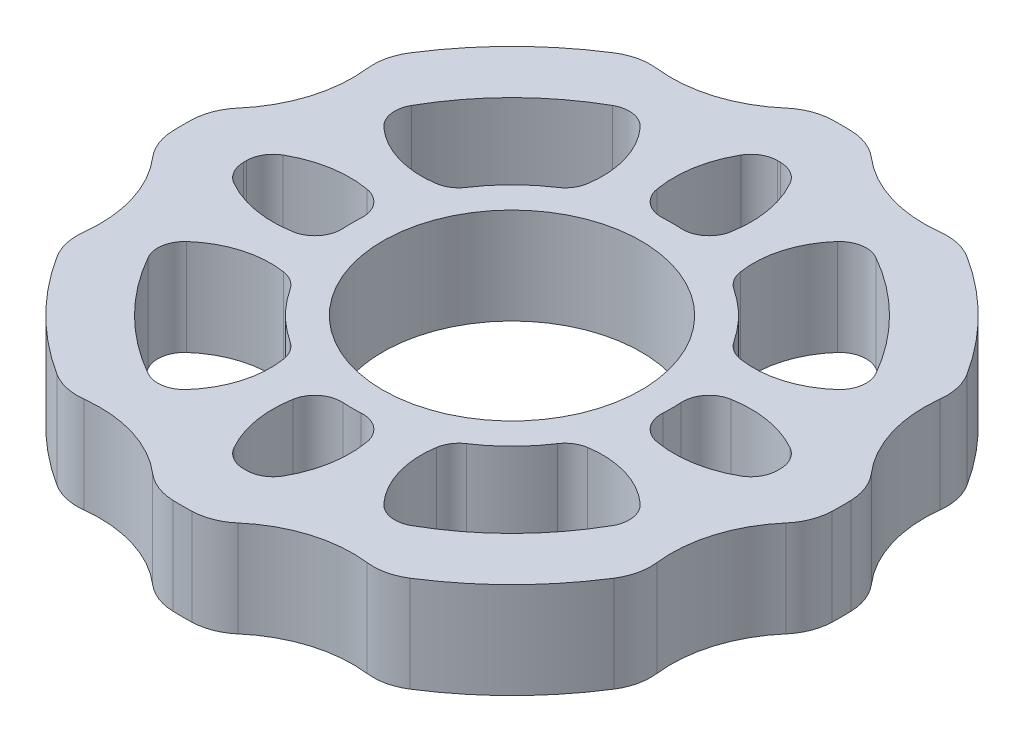
from build123d import *

# Parameters (mm, degrees)
SKIZZE1_R                       = 61.75
AUFSATZ_LINEAR_AUSTRAGEN1_DEPTH = 18
SKIZZE2_R                       = 24
SCHNITT_LINEAR_AUSTRAGEN1_DEPTH = 90.163473463
VERRUNDUNG1_R                   = 10
SCHNITT_LINEAR_AUSTRAGEN3_DEPTH = 90.163473622
SKIZZE6_R                       = 24.2
SCHNITT_LINEAR_AUSTRAGEN4_DEPTH = 90.163473622
KREISMUSTER1_COUNT              = 4
VERRUNDUNG1_OF_KREISMUSTER1_R   = 10
SCHNITT_LINEAR_AUSTRAGEN5_DEPTH = 90.163473622
VERRUNDUNG2_R                   = 5
KREISMUSTER2_COUNT              = 4
VERRUNDUNG2_OF_KREISMUSTER2_R   = 5
SKALIEREN1_SCALE                = 0.13


with BuildPart() as part:
    # Skizze1 → Aufsatz-Linear austragen1 (new body)
    with BuildSketch(Plane(origin=(0, 0, 0), x_dir=(1, 0, 0), z_dir=(0, 1, 0))):
        with Locations(Location((0, 0, 0), (0, 0, 270))):
            Circle(SKIZZE1_R)
    extrude(amount=AUFSATZ_LINEAR_AUSTRAGEN1_DEPTH)

    # Skizze2 → Schnitt-Linear austragen1 (cut, through all)
    with BuildSketch(Plane(origin=(0, 18, 0), x_dir=(1, 0, 0), z_dir=(0, 1, 0))):
        with Locations((23.68, 77.47)):
            Circle(SKIZZE2_R)
        with Locations((-23.68, 77.47)):
            Circle(SKIZZE2_R)
    schnitt_linear_austragen1 = extrude(amount=-SCHNITT_LINEAR_AUSTRAGEN1_DEPTH, mode=Mode.SUBTRACT)

    # Verrundung1
    verrundung1_edges = [part.edges().sort_by_distance(p)[0] for p in [
        (-29.577004439, 9, -54.205749773),
        (-5.783829144, 9, -61.478531378),
        (5.783829144, 9, -61.478531378),
        (29.577004439, 9, -54.205749773),
    ]]
    fillet(verrundung1_edges, radius=VERRUNDUNG1_R)

    # Skizze5 → Schnitt-Linear austragen3 (cut, through all)
    with BuildSketch(Plane(origin=(0, 18, 0), x_dir=(1, 0, 0), z_dir=(0, 1, 0))):
        with BuildLine():
            ThreePointArc((2.959586903, 49.912331596), (0, 50), (-2.959586903, 49.912331596))
            ThreePointArc((-2.959586903, 49.912331596), (-7.073744655, 40.055154921), (-5.527959125, 29.486296273))
            ThreePointArc((-5.527959125, 29.486296273), (0, 30), (5.527959125, 29.486296273))
            ThreePointArc((5.527959125, 29.486296273), (7.073744655, 40.055154921), (2.959586903, 49.912331596))
        make_face()
    schnitt_linear_austragen3 = extrude(amount=-SCHNITT_LINEAR_AUSTRAGEN3_DEPTH, mode=Mode.SUBTRACT)

    # Skizze6 → Schnitt-Linear austragen4 (cut, through all)
    with BuildSketch(Plane(origin=(0, 18, 0), x_dir=(1, 0, 0), z_dir=(0, 1, 0))):
        with Locations(Location((0, 0, 0), (0, 0, 270))):
            Circle(SKIZZE6_R)
    extrude(amount=-SCHNITT_LINEAR_AUSTRAGEN4_DEPTH, mode=Mode.SUBTRACT)

    # Kreismuster1: Schnitt-Linear austragen1, Schnitt-Linear austragen3 ×4 about axis
    kreismuster1_axis = Axis((0, 0, 0), (0, 1, 0))
    add([schnitt_linear_austragen1.rotate(kreismuster1_axis, i * 360 / KREISMUSTER1_COUNT) for i in range(1, KREISMUSTER1_COUNT)], mode=Mode.SUBTRACT)
    add([schnitt_linear_austragen3.rotate(kreismuster1_axis, i * 360 / KREISMUSTER1_COUNT) for i in range(1, KREISMUSTER1_COUNT)], mode=Mode.SUBTRACT)

    # Verrundung1 of Kreismuster1
    verrundung1_of_kreismuster1_edges = [part.edges().sort_by_distance(p)[0] for p in [
        (-54.205749773, 9, 29.577004439),
        (-61.478531378, 9, 5.783829144),
        (-61.478531378, 9, -5.783829144),
        (-54.205749773, 9, -29.577004439),
        (29.577004439, 9, 54.205749773),
        (5.783829144, 9, 61.478531378),
        (-5.783829144, 9, 61.478531378),
        (-29.577004439, 9, 54.205749773),
        (54.205749773, 9, -29.577004439),
        (61.478531378, 9, -5.783829144),
        (61.478531378, 9, 5.783829144),
        (54.205749773, 9, 29.577004439),
    ]]
    fillet(verrundung1_of_kreismuster1_edges, radius=VERRUNDUNG1_OF_KREISMUSTER1_R)

    # Skizze7 → Schnitt-Linear austragen5 (cut, through all)
    with BuildSketch(Plane(origin=(0, 18, 0), x_dir=(1, 0, 0), z_dir=(0, 1, 0))):
        with BuildLine():
            ThreePointArc((-14.885049849, 26.046790416), (-15.051255942, 36.683162183), (-21.506435351, 45.138378775))
            ThreePointArc((-21.506435351, 45.138378775), (-35.355339059, 35.355339059), (-45.138378775, 21.506435351))
            ThreePointArc((-45.138378775, 21.506435351), (-36.683162183, 15.051255942), (-26.046790416, 14.885049849))
            ThreePointArc((-26.046790416, 14.885049849), (-21.213203436, 21.213203436), (-14.885049849, 26.046790416))
        make_face()
    schnitt_linear_austragen5 = extrude(amount=-SCHNITT_LINEAR_AUSTRAGEN5_DEPTH, mode=Mode.SUBTRACT)

    # Verrundung2
    verrundung2_edges = [part.edges().sort_by_distance(p)[0] for p in [
        (-29.486296273, 9, 5.527959125),
        (-49.912331596, 9, 2.959586903),
        (-49.912331596, 9, -2.959586903),
        (-29.486296273, 9, -5.527959125),
        (5.527959125, 9, 29.486296273),
        (2.959586903, 9, 49.912331596),
        (-2.959586903, 9, 49.912331596),
        (-5.527959125, 9, 29.486296273),
        (29.486296273, 9, -5.527959125),
        (49.912331596, 9, -2.959586903),
        (49.912331596, 9, 2.959586903),
        (29.486296273, 9, 5.527959125),
        (-26.046790416, 9, -14.885049849),
        (-45.138378775, 9, -21.506435351),
        (-21.506435351, 9, -45.138378775),
        (-14.885049849, 9, -26.046790416),
        (-5.527959125, 9, -29.486296273),
        (-2.959586903, 9, -49.912331596),
        (2.959586903, 9, -49.912331596),
        (5.527959125, 9, -29.486296273),
    ]]
    fillet(verrundung2_edges, radius=VERRUNDUNG2_R)

    # Kreismuster2: Schnitt-Linear austragen5 ×4 about axis
    kreismuster2_axis = Axis((0, 0, 0), (0, 1, 0))
    for i in range(1, KREISMUSTER2_COUNT):
        add(schnitt_linear_austragen5.rotate(kreismuster2_axis, i * 360 / KREISMUSTER2_COUNT), mode=Mode.SUBTRACT)

    # Verrundung2 of Kreismuster2
    verrundung2_of_kreismuster2_edges = [part.edges().sort_by_distance(p)[0] for p in [
        (5.527959125, 9, 29.486296273),
        (2.959586903, 9, 49.912331596),
        (-2.959586903, 9, 49.912331596),
        (-5.527959125, 9, 29.486296273),
        (29.486296273, 9, -5.527959125),
        (49.912331596, 9, -2.959586903),
        (49.912331596, 9, 2.959586903),
        (29.486296273, 9, 5.527959125),
        (-5.527959125, 9, -29.486296273),
        (-2.959586903, 9, -49.912331596),
        (2.959586903, 9, -49.912331596),
        (5.527959125, 9, -29.486296273),
        (-14.885049849, 9, 26.046790416),
        (-21.506435351, 9, 45.138378775),
        (-45.138378775, 9, 21.506435351),
        (-26.046790416, 9, 14.885049849),
        (-29.486296273, 9, 5.527959125),
        (-49.912331596, 9, 2.959586903),
        (-49.912331596, 9, -2.959586903),
        (-29.486296273, 9, -5.527959125),
        (29.486296273, 9, -5.527959125),
        (49.912331596, 9, -2.959586903),
        (49.912331596, 9, 2.959586903),
        (29.486296273, 9, 5.527959125),
        (-5.527959125, 9, -29.486296273),
        (-2.959586903, 9, -49.912331596),
        (2.959586903, 9, -49.912331596),
        (5.527959125, 9, -29.486296273),
        (-29.486296273, 9, 5.527959125),
        (-49.912331596, 9, 2.959586903),
        (-49.912331596, 9, -2.959586903),
        (-29.486296273, 9, -5.527959125),
        (26.046790416, 9, 14.885049849),
        (45.138378775, 9, 21.506435351),
        (21.506435351, 9, 45.138378775),
        (14.885049849, 9, 26.046790416),
        (5.527959125, 9, 29.486296273),
        (2.959586903, 9, 49.912331596),
        (-2.959586903, 9, 49.912331596),
        (-5.527959125, 9, 29.486296273),
        (-5.527959125, 9, -29.486296273),
        (-2.959586903, 9, -49.912331596),
        (2.959586903, 9, -49.912331596),
        (5.527959125, 9, -29.486296273),
        (-29.486296273, 9, 5.527959125),
        (-49.912331596, 9, 2.959586903),
        (-49.912331596, 9, -2.959586903),
        (-29.486296273, 9, -5.527959125),
        (5.527959125, 9, 29.486296273),
        (2.959586903, 9, 49.912331596),
        (-2.959586903, 9, 49.912331596),
        (-5.527959125, 9, 29.486296273),
        (14.885049849, 9, -26.046790416),
        (21.506435351, 9, -45.138378775),
        (45.138378775, 9, -21.506435351),
        (26.046790416, 9, -14.885049849),
        (29.486296273, 9, -5.527959125),
        (49.912331596, 9, -2.959586903),
        (49.912331596, 9, 2.959586903),
        (29.486296273, 9, 5.527959125),
    ]]
    fillet(verrundung2_of_kreismuster2_edges, radius=VERRUNDUNG2_OF_KREISMUSTER2_R)


with BuildPart() as part_1:
    # Skalieren1: scaled about (0, 9, 0)
    add(part.part.scale(SKALIEREN1_SCALE).moved(Location((0, 7.83, 0))))


solid = part_1.part
